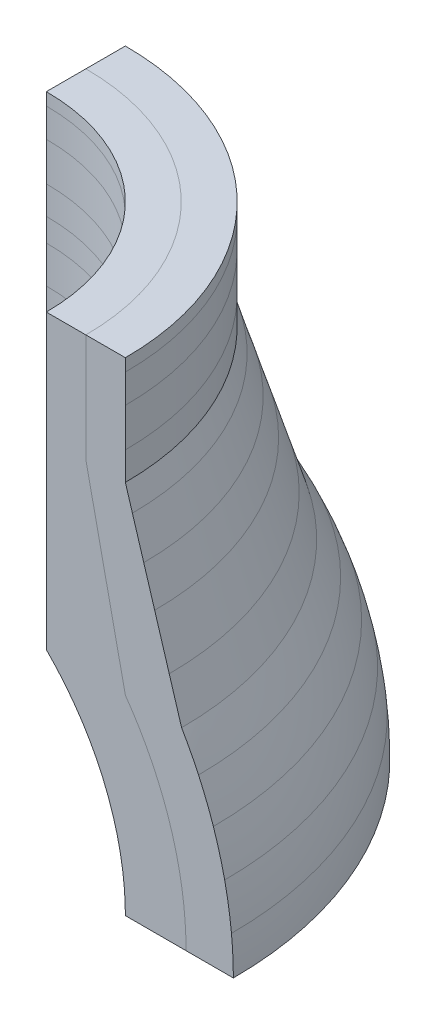
from build123d import *

# Parameters (mm, degrees)
REVOLVE2_ANGLE = 90
REVOLVE3_ANGLE = 90


with BuildPart() as part:
    # Sketch1 → Revolve2 (revolve)
    with BuildSketch(Plane.XY):
        with BuildLine():
            Line((707.106781187, 1790), (707.106781187, 707.106781187))
            ThreePointArc((707.106781187, 707.106781187), (923.879532511, 382.683432365), (1000, 0))
            Line((1000, 0), (1224.744871392, 0))
            ThreePointArc((1224.744871392, 0), (1167.207109169, 370.981892151), (1000, 707.106781187))
            Line((1000, 707.106781187), (853.553390593, 1390))
            Line((853.553390593, 1390), (853.553390593, 1790))
            Line((853.553390593, 1790), (707.106781187, 1790))
        make_face()
    revolve(axis=Axis((0, 355.703332398, 0), (0, 1, 0)), revolution_arc=REVOLVE2_ANGLE)


with BuildPart() as body_2:
    # Sketch1<4> → Revolve3 (revolve)
    with BuildSketch(Plane.XY):
        with BuildLine():
            Line((1000, 1790), (853.553390593, 1790))
            Line((853.553390593, 1790), (853.553390593, 1390))
            Line((853.553390593, 1390), (1000, 707.106781187))
            ThreePointArc((1000, 707.106781187), (1167.207109169, 370.981892151), (1224.744871392, 0))
            Line((1224.744871392, 0), (1400, 0))
            ThreePointArc((1400, 0), (1351.22656063, 366.315140075), (1208.304597359, 707.106781187))
            Line((1208.304597359, 707.106781187), (1000, 1390))
            Line((1000, 1390), (1000, 1790))
        make_face()
    revolve(axis=Axis((0, 355.703332398, 0), (0, 1, 0)), revolution_arc=REVOLVE3_ANGLE)


solid = Compound([part.part, body_2.part])
